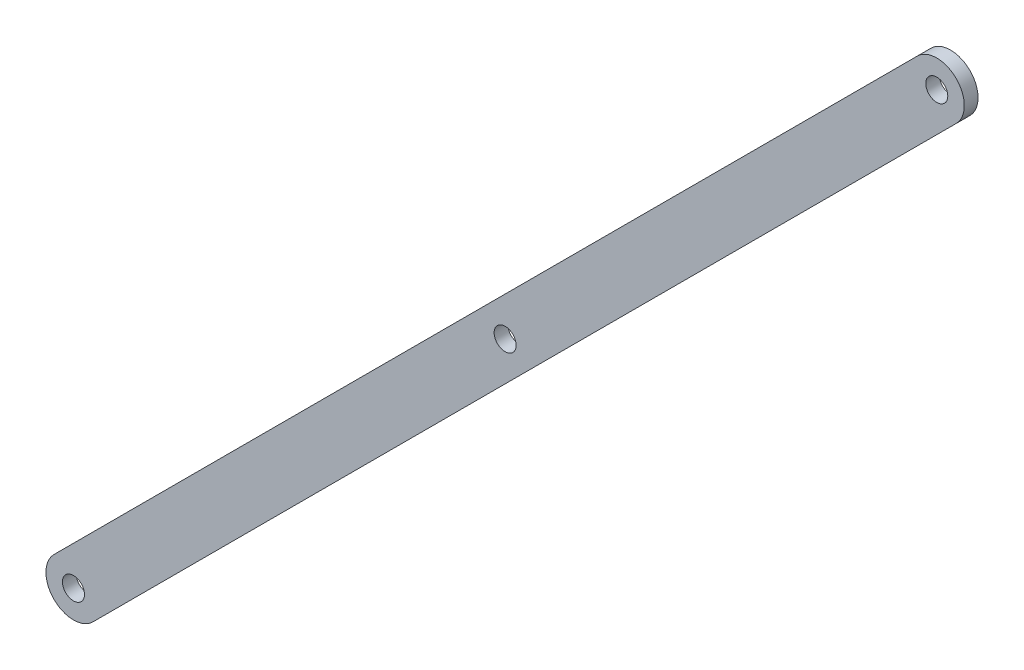
from build123d import *

# Parameters (mm, degrees)
CROQUIS1_R              = 4
SALIENTE_EXTRUIR1_DEPTH = 5


with BuildPart() as part:
    # Croquis1 → Saliente-Extruir1 (new body)
    with BuildSketch(Plane.XY):
        with BuildLine():
            Line((-7.071067812, 7.071067812), (306.601500322, 320.743635946))
            ThreePointArc((306.601500322, 320.743635946), (320.743635946, 320.743635946), (320.743635946, 306.601500322))
            Line((320.743635946, 306.601500322), (7.071067812, -7.071067812))
            ThreePointArc((7.071067812, -7.071067812), (-7.071067812, -7.071067812), (-7.071067812, 7.071067812))
        make_face()
        with Locations((313.672568134, 313.672568134)):
            Circle(CROQUIS1_R, mode=Mode.SUBTRACT)
        Circle(CROQUIS1_R, mode=Mode.SUBTRACT)
        with Locations((156.836284067, 156.836284067)):
            Circle(CROQUIS1_R, mode=Mode.SUBTRACT)
    extrude(amount=SALIENTE_EXTRUIR1_DEPTH)


solid = part.part
